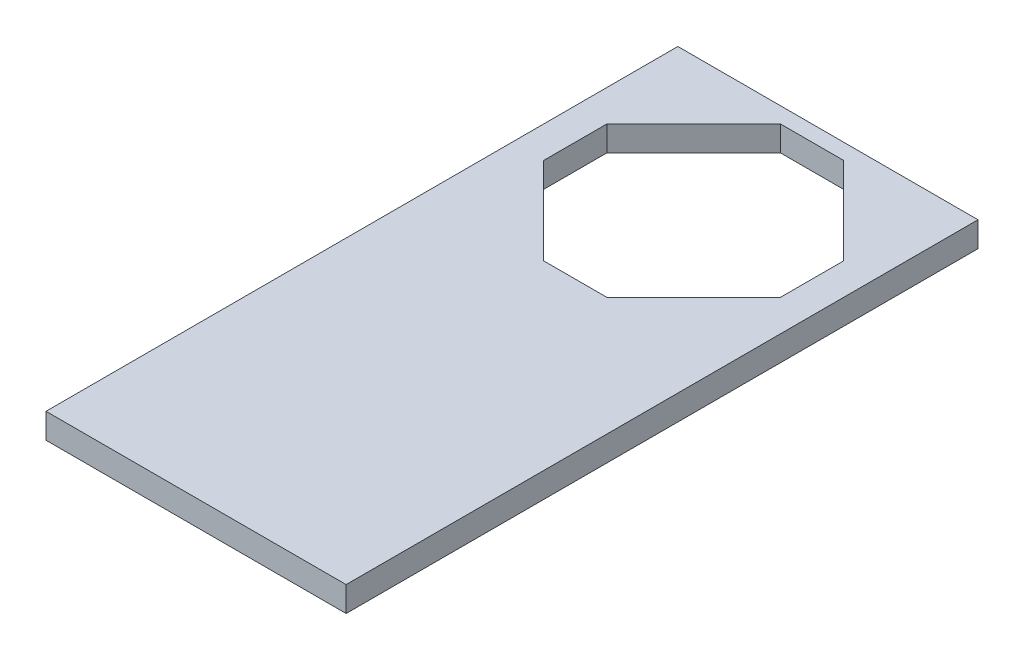
from build123d import *

# Parameters (mm, degrees)
SKETCH1_W           = 19
SKETCH1_H           = 1.5875
BOSS_EXTRUDE1_DEPTH = 40
CUT_EXTRUDE1_DEPTH  = 45.31162552


with BuildPart() as part:
    # Sketch1 → Boss-Extrude1 (new body)
    with BuildSketch(Plane.XY):
        with Locations((9.5, 0.79375)):
            Rectangle(SKETCH1_W, SKETCH1_H)
    extrude(amount=BOSS_EXTRUDE1_DEPTH)

    # Sketch2 → Cut-Extrude1 (cut, through all)
    with BuildSketch(Plane(origin=(0, 1.5875, 0), x_dir=(1, 0, 0), z_dir=(0, 1, 0))):
        Polygon((2, -10.5), (7.5, -16), (11.5, -16), (17, -10.5), (17, -6.5), (11.5, -1), (7.5, -1), (2, -6.5), align=None)
    extrude(amount=-CUT_EXTRUDE1_DEPTH, mode=Mode.SUBTRACT)


solid = part.part
